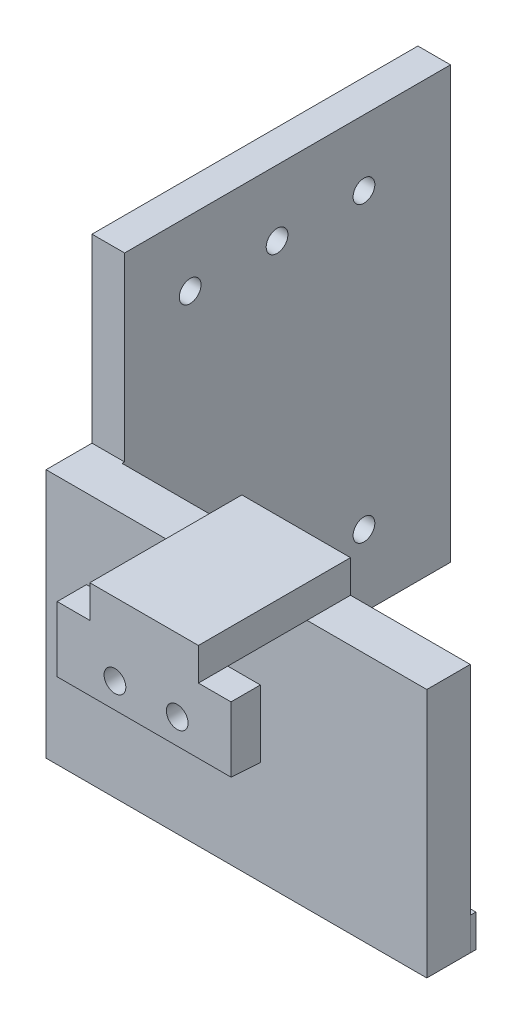
from build123d import *

# Parameters (mm, degrees)
ESQUISSE1_R             = 1
BOSS_EXTRU_1_DEPTH      = 3
ESQUISSE2_W             = 32.050081832
ESQUISSE2_H             = 3
BOSS_EXTRU_2_DEPTH      = 4
ESQUISSE3_W             = 32.050081832
ESQUISSE3_H             = 4
BOSS_EXTRU_3_DEPTH      = 20
BOSS_EXTRU_4_DEPTH      = 10
BOSS_EXTRU_4_DEPTH_BACK = 4
ESQUISSE5_W             = 10
ESQUISSE5_H             = 2.701469748
BOSS_EXTRU_5_DEPTH      = 6
BOSS_EXTRU_6_DEPTH      = 3
ESQUISSE7_W             = 2.701469748
ESQUISSE7_H             = 6
BOSS_EXTRU_7_DEPTH      = 3
ESQUISSE8_R             = 1
ENL_V_MAT_EXTRU_1_DEPTH = 5
ESQUISSE9_W             = 32.395093649
ESQUISSE9_H             = 3
ENL_V_MAT_EXTRU_2_DEPTH = 24
ESQUISSE10_W            = 4.230170434
ESQUISSE10_H            = 23
BOSS_EXTRU_8_DEPTH      = 3
ESQUISSE11_W            = 3
ESQUISSE11_H            = 39.66165995
BOSS_EXTRU_9_DEPTH      = 30
ESQUISSE12_R            = 1
ENL_V_MAT_EXTRU_3_DEPTH = 30


with BuildPart() as part:
    # Esquisse1 → Boss.-Extru.1 (new body)
    with BuildSketch(Plane(origin=(0, 0, 0), x_dir=(1, 0, 0), z_dir=(0, 1, 0))):
        Polygon((-38.959245403, 34.630440358), (-6.759245403, 34.630440358), (-6.909163571, 10.109841365), (-38.959245403, 10.109841365), align=None)
        with Locations(Location((-36.509163571, 15.109841365, 0), (0, 0, 270))):
            Circle(ESQUISSE1_R, mode=Mode.SUBTRACT)
        with Locations(Location((-9.509163571, 15.109841365, 0), (0, 0, 270))):
            Circle(ESQUISSE1_R, mode=Mode.SUBTRACT)
        with Locations(Location((-36.509163571, 23.109841365, 0), (0, 0, 270))):
            Circle(ESQUISSE1_R, mode=Mode.SUBTRACT)
        with Locations(Location((-9.509163571, 23.109841365, 0), (0, 0, 270))):
            Circle(ESQUISSE1_R, mode=Mode.SUBTRACT)
        with Locations(Location((-36.509163571, 31.109841365, 0), (0, 0, 270))):
            Circle(ESQUISSE1_R, mode=Mode.SUBTRACT)
        with Locations(Location((-9.509163571, 31.109841365, 0), (0, 0, 270))):
            Circle(ESQUISSE1_R, mode=Mode.SUBTRACT)
    extrude(amount=BOSS_EXTRU_1_DEPTH)

    # Esquisse2 → Boss.-Extru.2 (add)
    with BuildSketch(Plane.XY.offset(-10.109841365)):
        with Locations((-22.934204487, 1.5)):
            Rectangle(ESQUISSE2_W, ESQUISSE2_H)
    extrude(amount=BOSS_EXTRU_2_DEPTH)

    # Esquisse3 → Boss.-Extru.3 (add)
    with BuildSketch(Plane(origin=(0, 3, 0), x_dir=(1, 0, 0), z_dir=(0, 1, 0))):
        with Locations((-22.934204487, 8.109841365)):
            Rectangle(ESQUISSE3_W, ESQUISSE3_H)
    extrude(amount=BOSS_EXTRU_3_DEPTH)

    # Esquisse4 → Boss.-Extru.4 (add, two sides: drawn at the far end of the back side and taken through both)
    with BuildSketch(Plane.XY.offset(-6.109841365).offset(-BOSS_EXTRU_4_DEPTH_BACK)):
        Polygon((-22.934204487, 23), (-17.934204487, 23), (-17.934204487, 26), (-27.934204487, 26), (-27.934204487, 23), align=None)
    extrude(amount=BOSS_EXTRU_4_DEPTH + BOSS_EXTRU_4_DEPTH_BACK)

    # Esquisse5 → Boss.-Extru.5 (add)
    with BuildSketch(Plane.XZ.offset(-23)):
        with Locations((-22.934204487, 2.539423761)):
            Rectangle(ESQUISSE5_W, ESQUISSE5_H)
    extrude(amount=BOSS_EXTRU_5_DEPTH)

    # Esquisse6 → Boss.-Extru.6 (add)
    with BuildSketch(Plane(origin=(-17.934204487, 0, 0), x_dir=(0, 0, -1), z_dir=(1, 0, 0))):
        Polygon((-1.188688887, 23), (-3.890158635, 23), (-3.890158635, 17), (-1.188688887, 16.813684491), align=None)
    extrude(amount=BOSS_EXTRU_6_DEPTH)

    # Esquisse7 → Boss.-Extru.7 (add)
    with BuildSketch(Plane.ZY.offset(27.934204487)):
        with Locations((2.539423761, 20)):
            Rectangle(ESQUISSE7_W, ESQUISSE7_H)
    extrude(amount=BOSS_EXTRU_7_DEPTH)

    # Esquisse8 → Enlèv. mat.-Extru.1 (cut)
    with BuildSketch(Plane.XY.offset(3.890158635)):
        with Locations((-25.616934949, 19.323429725)):
            Circle(ESQUISSE8_R)
        with Locations((-19.884204487, 19.323429725)):
            Circle(ESQUISSE8_R)
    extrude(amount=-ENL_V_MAT_EXTRU_1_DEPTH, mode=Mode.SUBTRACT)

    # Esquisse9 → Enlèv. mat.-Extru.2 (cut)
    with BuildSketch(Plane(origin=(0, 0, -34.630440358), x_dir=(-1, 0, 0), z_dir=(0, 0, -1))):
        with Locations((22.956792228, 1.5)):
            Rectangle(ESQUISSE9_W, ESQUISSE9_H)
    extrude(amount=-ENL_V_MAT_EXTRU_2_DEPTH, mode=Mode.SUBTRACT)

    # Esquisse10 → Boss.-Extru.8 (add)
    with BuildSketch(Plane.ZY.offset(38.959245403)):
        with Locations((-8.224926582, 11.5)):
            Rectangle(ESQUISSE10_W, ESQUISSE10_H)
    extrude(amount=BOSS_EXTRU_8_DEPTH)

    # Esquisse11 → Boss.-Extru.9 (add)
    with BuildSketch(Plane(origin=(0, 0, -10.340011799), x_dir=(-1, 0, 0), z_dir=(0, 0, -1))):
        with Locations((40.459245403, 19.830829975)):
            Rectangle(ESQUISSE11_W, ESQUISSE11_H)
    extrude(amount=BOSS_EXTRU_9_DEPTH)

    # Esquisse12 → Enlèv. mat.-Extru.3 (cut)
    with BuildSketch(Plane(origin=(-41.959245403, -0.142686019, -42.326053617), x_dir=(0, -1, 0), z_dir=(-1, 0, 0))):
        with Locations(Location((-33.753075005, 25.951540398, 0), (0, 0, 90))):
            Circle(ESQUISSE12_R)
        with Locations(Location((-33.753075005, 17.951540398, 0), (0, 0, 90))):
            Circle(ESQUISSE12_R)
        with Locations(Location((-6.753075005, 25.951540398, 0), (0, 0, 90))):
            Circle(ESQUISSE12_R)
        with Locations(Location((-6.753075005, 17.951540398, 0), (0, 0, 90))):
            Circle(ESQUISSE12_R)
        with Locations(Location((-6.753075005, 9.951540398, 0), (0, 0, 90))):
            Circle(ESQUISSE12_R)
        with Locations(Location((-33.753075005, 9.951540398, 0), (0, 0, 90))):
            Circle(ESQUISSE12_R)
    extrude(amount=-ENL_V_MAT_EXTRU_3_DEPTH, mode=Mode.SUBTRACT)


solid = part.part
